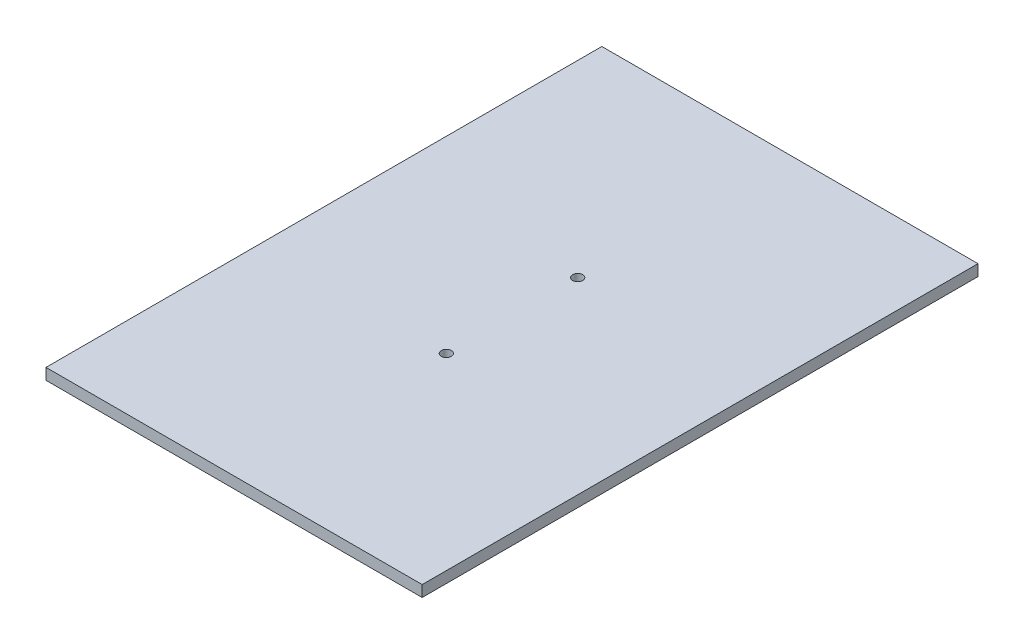
from build123d import *

# Parameters (mm, degrees)
SKIZZE1_W                       = 335
SKIZZE1_H                       = 10
AUFSATZ_LINEAR_AUSTRAGEN1_DEPTH = 247.5
DURCHGANGSLOCH_F_R_M81_D        = 9


with BuildPart() as part:
    # Skizze1 → Aufsatz-Linear austragen1 (new, symmetric)
    with BuildSketch(Plane.XY):
        Rectangle(SKIZZE1_W, SKIZZE1_H)
    extrude(amount=AUFSATZ_LINEAR_AUSTRAGEN1_DEPTH, both=True)

    # Durchgangsloch für M81 (through all)
    with Locations(Plane(origin=(0, 5, 0), x_dir=(1, 0, 0), z_dir=(0, 1, 0))):
        with Locations((0, 58.5), (0, -58.5)):
            Hole(DURCHGANGSLOCH_F_R_M81_D / 2)


solid = part.part
